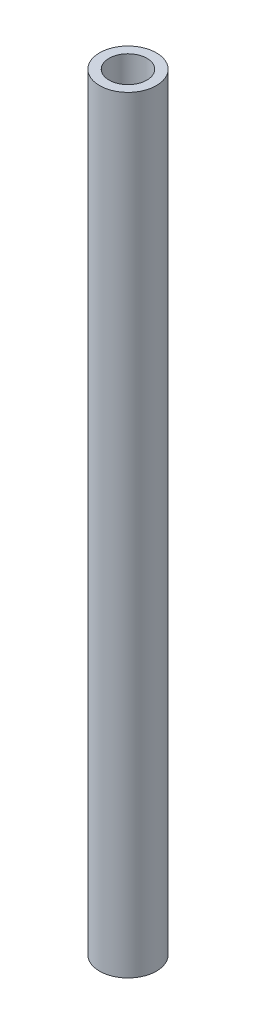
from build123d import *

# Parameters (mm, degrees)
BASE_OUTLINE_SKETCH_R   = 3
BASE_OUTLINE_SKETCH_R_2 = 2
BASE_OUTLINE_DEPTH      = 81


with BuildPart() as part:
    # Base Outline Sketch → Base Outline (new body)
    with BuildSketch(Plane(origin=(0, 69.6, 0), x_dir=(1, 0, 0), z_dir=(0, 1, 0))):
        with Locations(Location((-56.291651246, -50, 0), (0, 0, 270))):
            Circle(BASE_OUTLINE_SKETCH_R)
        with Locations(Location((-56.291651246, -50, 0), (0, 0, 270))):
            Circle(BASE_OUTLINE_SKETCH_R_2, mode=Mode.SUBTRACT)
    extrude(amount=BASE_OUTLINE_DEPTH)


solid = part.part
